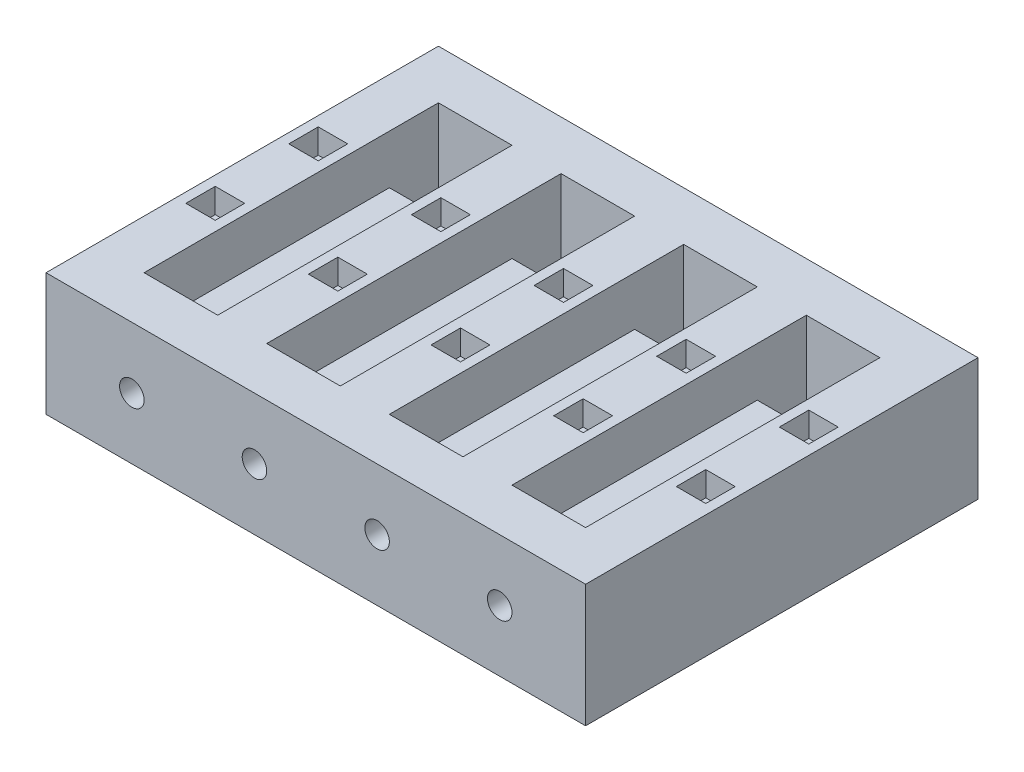
from build123d import *

# Parameters (mm, degrees)
SKETCH1_W           = 110
SKETCH1_H           = 25
BOSS_EXTRUDE1_DEPTH = 80
SKETCH2_W           = 15
SKETCH2_H           = 10
CUT_EXTRUDE1_DEPTH  = 15
SKETCH4_R           = 2.5
CUT_EXTRUDE2_DEPTH  = 10
SKETCH5_W           = 15
SKETCH5_H           = 40
CUT_EXTRUDE3_DEPTH  = 10
SKETCH6_W           = 6
SKETCH6_H           = 6
CUT_EXTRUDE4_DEPTH  = 5


with BuildPart() as part:
    # Sketch1 → Boss-Extrude1 (new body)
    with BuildSketch(Plane.XY):
        with Locations((55, 12.5)):
            Rectangle(SKETCH1_W, SKETCH1_H)
    extrude(amount=-BOSS_EXTRUDE1_DEPTH)

    # Sketch2 → Cut-Extrude1 (cut)
    with BuildSketch(Plane(origin=(0, 25, 0), x_dir=(1, 0, 0), z_dir=(0, 1, 0))):
        with Locations((17.5, 15)):
            Rectangle(SKETCH2_W, SKETCH2_H)
        with Locations((17.5, 65)):
            Rectangle(SKETCH2_W, SKETCH2_H)
        with Locations((42.5, 15)):
            Rectangle(SKETCH2_W, SKETCH2_H)
        with Locations((42.5, 65)):
            Rectangle(SKETCH2_W, SKETCH2_H)
        with Locations((67.5, 15)):
            Rectangle(SKETCH2_W, SKETCH2_H)
        with Locations((67.5, 65)):
            Rectangle(SKETCH2_W, SKETCH2_H)
        with Locations((92.5, 15)):
            Rectangle(SKETCH2_W, SKETCH2_H)
        with Locations((92.5, 65)):
            Rectangle(SKETCH2_W, SKETCH2_H)
    extrude(amount=-CUT_EXTRUDE1_DEPTH, mode=Mode.SUBTRACT)

    # Sketch4 → Cut-Extrude2 (cut)
    with BuildSketch(Plane.XY):
        with Locations((17.5, 12.5)):
            Circle(SKETCH4_R)
        with Locations((42.5, 12.5)):
            Circle(SKETCH4_R)
        with Locations((67.5, 12.5)):
            Circle(SKETCH4_R)
        with Locations((92.5, 12.5)):
            Circle(SKETCH4_R)
    cut_extrude2 = extrude(amount=-CUT_EXTRUDE2_DEPTH, mode=Mode.SUBTRACT)

    # Mirror1: Cut-Extrude2 across plane
    add(cut_extrude2.mirror(Plane.XY.offset(-40)), mode=Mode.SUBTRACT)

    # Sketch5 → Cut-Extrude3 (cut)
    with BuildSketch(Plane(origin=(0, 25, 0), x_dir=(1, 0, 0), z_dir=(0, 1, 0))):
        with Locations((42.5, 40)):
            Rectangle(SKETCH5_W, SKETCH5_H)
        with Locations((17.5, 40)):
            Rectangle(SKETCH5_W, SKETCH5_H)
        with Locations((67.5, 40)):
            Rectangle(SKETCH5_W, SKETCH5_H)
        with Locations((92.5, 40)):
            Rectangle(SKETCH5_W, SKETCH5_H)
    extrude(amount=-CUT_EXTRUDE3_DEPTH, mode=Mode.SUBTRACT)

    # Sketch6 → Cut-Extrude4 (cut)
    with BuildSketch(Plane(origin=(0, 25, 0), x_dir=(1, 0, 0), z_dir=(0, 1, 0))):
        with Locations((5, 50.5)):
            Rectangle(SKETCH6_W, SKETCH6_H)
        with Locations((30, 50.5)):
            Rectangle(SKETCH6_W, SKETCH6_H)
        with Locations((55, 50.5)):
            Rectangle(SKETCH6_W, SKETCH6_H)
        with Locations((80, 50.5)):
            Rectangle(SKETCH6_W, SKETCH6_H)
        with Locations((105, 50.5)):
            Rectangle(SKETCH6_W, SKETCH6_H)
        with Locations((30, 29.5)):
            Rectangle(SKETCH6_W, SKETCH6_H)
        with Locations((55, 29.5)):
            Rectangle(SKETCH6_W, SKETCH6_H)
        with Locations((80, 29.5)):
            Rectangle(SKETCH6_W, SKETCH6_H)
        with Locations((105, 29.5)):
            Rectangle(SKETCH6_W, SKETCH6_H)
        with Locations((5, 29.5)):
            Rectangle(SKETCH6_W, SKETCH6_H)
    extrude(amount=-CUT_EXTRUDE4_DEPTH, mode=Mode.SUBTRACT)


solid = part.part
